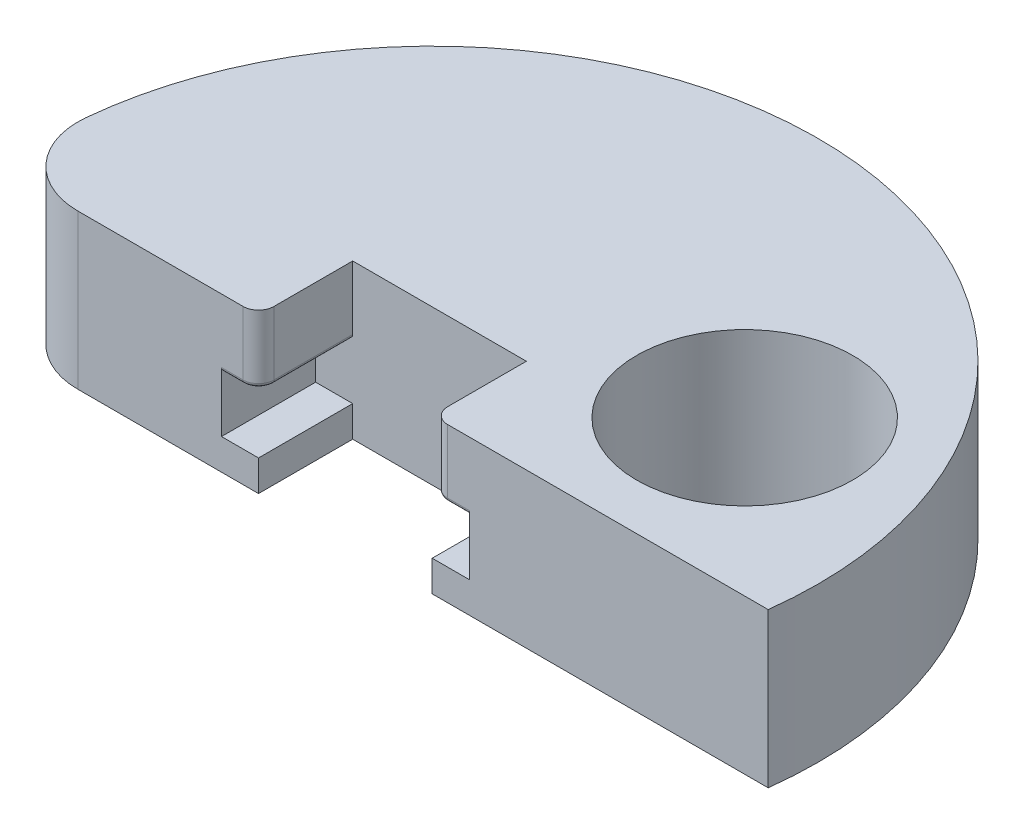
from build123d import *

# Parameters (mm, degrees)
SKETCH1_R           = 50
BOSS_EXTRUDE1_DEPTH = 20
CUT_EXTRUDE3_DEPTH  = 74.484692283
SKETCH14_W          = 22.5
SKETCH14_H          = 12.2
CUT_EXTRUDE4_DEPTH  = 74.484692283
SKETCH16_W          = 4.8
SKETCH16_H          = 12.2
CUT_EXTRUDE5_DEPTH  = 11.25
CUT_EXTRUDE7_START  = -11.25
SKETCH17_R          = 0.5
CUT_EXTRUDE7_DEPTH  = 0.4
CUT_EXTRUDE8_DEPTH  = 74.484692283
FILLET1_R           = 2
FILLET2_R           = 0.5
SKETCH4_R           = 14
CUT_EXTRUDE2_DEPTH  = 74.484692283
SKETCH20_W          = 4.8
SKETCH20_H          = 12.2
BOSS_EXTRUDE2_DEPTH = 4
FILLET3_R           = 10


with BuildPart() as part:
    # Sketch1 → Boss-Extrude1 (new body)
    with BuildSketch(Plane(origin=(0, 0, 0), x_dir=(1, 0, 0), z_dir=(0, 1, 0))):
        with Locations(Location((0, 0, 0), (0, 0, 270))):
            Circle(SKETCH1_R)
    extrude(amount=BOSS_EXTRUDE1_DEPTH)

    # Sketch15 → Cut-Extrude3 (cut, through all)
    with BuildSketch(Plane.XZ):
        with BuildLine():
            Line((-21.2, 6.1), (-21.2, 45.283109434))
            ThreePointArc((-21.2, 45.283109434), (-5.873377692, 49.65383605), (10.05, 48.979562064))
            Line((10.05, 48.979562064), (10.9, 6.1))
            Line((10.9, 6.1), (-21.2, 6.1))
        make_face()
    extrude(amount=-CUT_EXTRUDE3_DEPTH, mode=Mode.SUBTRACT)

    # Sketch14 → Cut-Extrude4 (cut, through all)
    with BuildSketch(Plane.XZ):
        with Locations((-5.15, 0)):
            Rectangle(SKETCH14_W, SKETCH14_H)
    extrude(amount=-CUT_EXTRUDE4_DEPTH, mode=Mode.SUBTRACT)

    # Sketch16 → Cut-Extrude5 (cut)
    with BuildSketch(Plane.XZ):
        with Locations((-18.8, 0)):
            Rectangle(SKETCH16_W, SKETCH16_H)
        with Locations((8.5, 0)):
            Rectangle(SKETCH16_W, SKETCH16_H)
    extrude(amount=-CUT_EXTRUDE5_DEPTH, mode=Mode.SUBTRACT)

    # Sketch17 → Cut-Extrude7 (cut)
    with BuildSketch(Plane.XZ.offset(CUT_EXTRUDE7_START)):
        with Locations(Location((8.75, 0, 0), (0, 0, 270))):
            Circle(SKETCH17_R)
        with Locations(Location((-19.05, 0, 0), (0, 0, 270))):
            Circle(SKETCH17_R)
    extrude(amount=-CUT_EXTRUDE7_DEPTH, mode=Mode.SUBTRACT)

    # Sketch18 → Cut-Extrude8 (cut, through all)
    with BuildSketch(Plane(origin=(0, 0, 0), x_dir=(-1, 0, 0), z_dir=(0, -1, 0))):
        with BuildLine():
            Line((-10.9, -6.1), (-49.626505015, -6.1))
            ThreePointArc((-49.626505015, -6.1), (0, -50), (49.626505015, -6.1))
            Line((49.626505015, -6.1), (-10.9, -6.1))
        make_face()
    extrude(amount=-CUT_EXTRUDE8_DEPTH, mode=Mode.SUBTRACT)

    # Fillet1
    fillet1_edges = [part.edges().sort_by_distance(p)[0] for p in [
        (-16.4, 15.625, 6.1),
        (6.1, 15.625, 6.1),
    ]]
    fillet(fillet1_edges, radius=FILLET1_R)

    # Fillet2
    fillet2_edges = [part.edges().sort_by_distance(p)[0] for p in [
        (-19.8, 11.25, 6.1),
        (-16.985786438, 11.25, 5.514213562),
        (6.1, 11.25, -1),
        (6.685786438, 11.25, 5.514213562),
        (-16.4, 11.25, -1),
        (9.5, 11.25, 6.1),
    ]]
    fillet(fillet2_edges, radius=FILLET2_R)

    # Sketch4 → Cut-Extrude2 (cut, through all)
    with BuildSketch(Plane(origin=(0, 20, 0), x_dir=(1, 0, 0), z_dir=(0, 1, 0))):
        with Locations(Location((26.585522376, 13.9, 0), (0, 0, 270))):
            Circle(SKETCH4_R)
    extrude(amount=-CUT_EXTRUDE2_DEPTH, mode=Mode.SUBTRACT)

    # Sketch20 → Boss-Extrude2 (add)
    with BuildSketch(Plane.XZ):
        with Locations((-18.8, 0)):
            Rectangle(SKETCH20_W, SKETCH20_H)
        with Locations((8.5, 0)):
            Rectangle(SKETCH20_W, SKETCH20_H)
    extrude(amount=-BOSS_EXTRUDE2_DEPTH)

    # Fillet3
    fillet3_edges = [part.edges().sort_by_distance(p)[0] for p in [
        (-49.626505015, 10, 6.1),
    ]]
    fillet(fillet3_edges, radius=FILLET3_R)


solid = part.part
